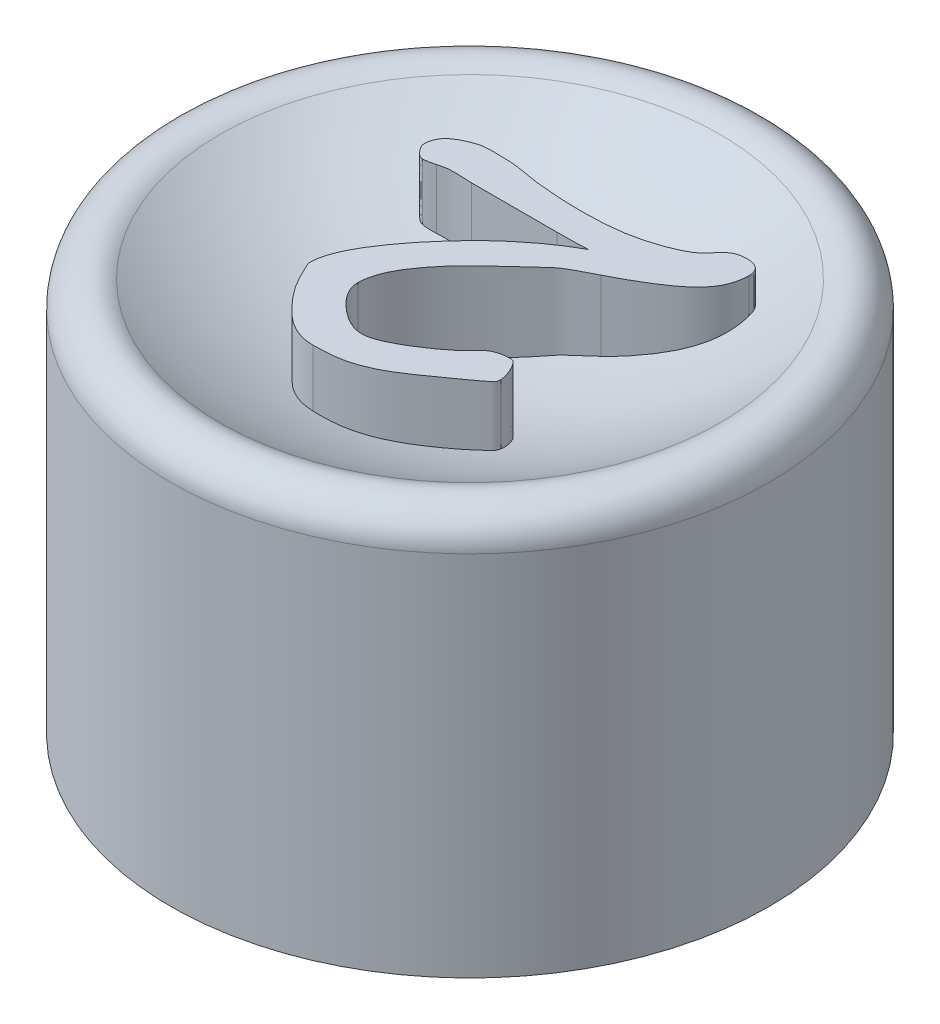
from build123d import *

# Parameters (mm, degrees)
BOSS_EXTRUDE1_REACH      = 11.257
BOSS_EXTRUDE1_END_RADIUS = 7.2532875


with BuildPart() as part:
    # Sketch1 → Revolve1 (revolve)
    with BuildSketch(Plane.XY):
        with BuildLine():
            Line((-1.5494, 0), (-1.5494, 3.048))
            Line((-1.5494, 3.048), (-0.762, 3.048))
            Line((-0.762, 3.048), (-0.762, 4.064))
            Line((-0.762, 4.064), (0, 4.064))
            Line((0, 4.064), (0, 5.08))
            ThreePointArc((0, 5.08), (-2.074697908, 5.383049508), (-3.976029965, 6.266874616))
            ThreePointArc((-3.976029965, 6.266874616), (-4.495955195, 6.288948978), (-4.7625, 5.842))
            Line((-4.7625, 5.842), (-4.7625, 0))
            Line((-4.7625, 0), (-3.4925, 0))
            Line((-3.4925, 0), (-3.4925, 4.064))
            Line((-3.4925, 4.064), (-2.0574, 4.064))
            Line((-2.0574, 4.064), (-2.0574, 0))
            Line((-2.0574, 0), (-1.5494, 0))
        make_face()
    revolve(axis=Axis((0, 0, 0), (0, -1, 0)))

    # Boss-Extrude1: up to this sphere (the profile starts inside it)
    boss_extrude1_end = Location((0, 12.3332875, 0)) * Sphere(BOSS_EXTRUDE1_END_RADIUS, mode=Mode.PRIVATE)
    # Sketch3 → Boss-Extrude1 (add, up to the surface)
    with BuildSketch(Plane(origin=(0, 6.35, 0), x_dir=(-1, 0, 0), z_dir=(0, 1, 0)), mode=Mode.PRIVATE) as boss_extrude1_sk1:
        with BuildLine():
            add(Edge.make_bspline(
                [(-0.625454905, -1.261484771), (-0.59469062, -1.25950277), (-0.526293563, -1.255096264), (-0.413249599, -1.250224058), (-0.279446192, -1.249130747), (-0.183365385, -1.248588222), (-0.131873022, -1.248297468)],
                knots=[0, 0, 0, 0, 0.749056732, 1.665349175, 2.748796024, 4, 4, 4, 4], degree=3))
            add(Edge.make_bspline(
                [(-0.131873022, -1.248297468), (-0.094822983, -1.248297468), (-0.015385186, -1.248297468), (0.112406052, -1.248297468), (0.25683841, -1.248297468), (0.418539854, -1.248297468), (0.596882417, -1.248297468), (0.792180083, -1.248297468), (1.004118869, -1.248297468), (1.151063093, -1.248297468), (1.227361056, -1.248297468)],
                knots=[0, 0, 0, 0, 0.654192654, 1.402633403, 2.256410256, 3.204435204, 4.257796258, 5.405405405, 6.652806653, 8, 8, 8, 8], degree=3))
            add(Edge.make_bspline(
                [(1.227361056, -1.248297468), (1.266920314, -1.250171463), (1.33817871, -1.253547103), (1.433307706, -1.258180588), (1.504903392, -1.258318447), (1.573362551, -1.260008029), (1.654229026, -1.247318142), (1.717367575, -1.230477037), (1.752969244, -1.220980914)],
                knots=[0, 0, 0, 0, 1.345730483, 2.42407467, 3.234936559, 3.779020466, 4.74766559, 6, 6, 6, 6], degree=3))
            add(Edge.make_bspline(
                [(1.752969244, -1.220980914), (1.773032762, -1.216118483), (1.810215907, -1.207107078), (1.862352702, -1.196767521), (1.906602491, -1.189212907), (1.93380023, -1.188385775), (1.946069027, -1.188012658)],
                knots=[0, 0, 0, 0, 1.261736286, 2.338339864, 3.250431406, 4, 4, 4, 4], degree=3))
            add(Edge.make_bspline(
                [(1.946069027, -1.188012658), (1.955706009, -1.188902496), (1.976545755, -1.190826749), (2.006077469, -1.209860248), (2.038490897, -1.235035084), (2.069676258, -1.269915196), (2.100379298, -1.305890557), (2.121699121, -1.34282066), (2.136802351, -1.376546879), (2.139053563, -1.398882071), (2.140110759, -1.409370945)],
                knots=[0, 0, 0, 0, 0.736164041, 1.591937357, 2.642832563, 3.909839565, 5.183763854, 6.279688426, 7.192120982, 8, 8, 8, 8], degree=3))
            add(Edge.make_bspline(
                [(2.140110759, -1.409370945), (2.139262041, -1.426359916), (2.1376141, -1.459347111), (2.12831116, -1.507848604), (2.11073324, -1.552782617), (2.088628361, -1.596138544), (2.057124747, -1.634826974), (2.020789722, -1.671893968), (1.976364606, -1.704738283), (1.911750283, -1.744711804), (1.828207184, -1.785363086), (1.73068096, -1.822729062), (1.638188264, -1.846039901), (1.578195235, -1.849493934), (1.54950801, -1.85114557)],
                knots=[0, 0, 0, 0, 0.756822681, 1.46950967, 2.186023927, 2.898847958, 3.625783312, 4.396672156, 5.204558736, 6.077194631, 7.777390643, 9.3298382, 10.72319279, 12, 12, 12, 12], degree=3))
            Line((1.54950801, -1.85114557), (1.433648141, -1.85114557))
            add(Edge.make_bspline(
                [(1.433648141, -1.85114557), (1.387173127, -1.85080693), (1.300463045, -1.850175118), (1.180370317, -1.845112092), (1.080004307, -1.835287047), (1.020400773, -1.824764773), (0.993757417, -1.820061214)],
                knots=[0, 0, 0, 0, 1.26272939, 2.355919009, 3.265079878, 4, 4, 4, 4], degree=3))
            add(Edge.make_bspline(
                [(0.993757417, -1.820061214), (0.956424278, -1.812985843), (0.879733989, -1.79845151), (0.761116211, -1.779352812), (0.635680481, -1.764626132), (0.503719792, -1.752780155), (0.365301614, -1.74172931), (0.220130555, -1.736095205), (0.068489985, -1.730519236), (-0.034846028, -1.730556782), (-0.087601365, -1.730575949)],
                knots=[0, 0, 0, 0, 0.839077289, 1.723645074, 2.652459622, 3.627336184, 4.649421482, 5.71829468, 6.835138602, 8, 8, 8, 8], degree=3))
            add(Edge.make_bspline(
                [(-0.087601365, -1.730575949), (-0.17714781, -1.732161078), (-0.350627394, -1.735231971), (-0.602818636, -1.760103429), (-0.838401854, -1.800343911), (-1.021858212, -1.85024975), (-1.157283333, -1.895025353), (-1.248376013, -1.928273963), (-1.329809618, -1.96356549), (-1.402404837, -1.998392872), (-1.466726233, -2.03235218), (-1.520935465, -2.068748145), (-1.566682306, -2.104742073), (-1.591554033, -2.131543454), (-1.603199169, -2.144092069)],
                knots=[0, 0, 0, 0, 2.010650531, 3.895261437, 5.685206004, 7.371729088, 8.158868654, 8.888441449, 9.548604563, 10.150993829, 10.696874145, 11.179933583, 11.616038532, 12, 12, 12, 12], degree=3))
            add(Edge.make_bspline(
                [(-1.603199169, -2.144092069), (-1.625262241, -2.169418617), (-1.665705259, -2.215843796), (-1.723750128, -2.276020912), (-1.772371601, -2.32137845), (-1.815213414, -2.352474569), (-1.857642161, -2.371697124), (-1.90355589, -2.385017565), (-1.956222458, -2.391958372), (-1.993463253, -2.393107593), (-2.012947488, -2.393708861)],
                knots=[0, 0, 0, 0, 1.607183726, 2.946070294, 3.999260751, 4.787069689, 5.466056599, 6.217339558, 7.067319197, 8, 8, 8, 8], degree=3))
            add(Edge.make_bspline(
                [(-2.012947488, -2.393708861), (-2.032468039, -2.393026139), (-2.068995766, -2.391748599), (-2.119953899, -2.381406834), (-2.163268425, -2.364574025), (-2.199615366, -2.340682699), (-2.227392589, -2.308563686), (-2.247673856, -2.269982658), (-2.258780761, -2.224446225), (-2.260024397, -2.192190435), (-2.26068038, -2.175176424)],
                knots=[0, 0, 0, 0, 1.239034472, 2.31853671, 3.285102112, 4.17563982, 5.051769498, 5.952741383, 6.920129394, 8, 8, 8, 8], degree=3))
            add(Edge.make_bspline(
                [(-2.26068038, -2.175176424), (-2.259612361, -2.147827776), (-2.257502595, -2.093803203), (-2.245611359, -2.013912578), (-2.22274033, -1.937063604), (-2.194689903, -1.861410593), (-2.154603583, -1.789746412), (-2.108918466, -1.71915227), (-2.052361815, -1.652744721), (-1.988521968, -1.586587854), (-1.913945258, -1.521492576), (-1.828599365, -1.454434893), (-1.73172978, -1.385087282), (-1.62326013, -1.31356441), (-1.503228271, -1.240331639), (-1.372453758, -1.164004794), (-1.229963835, -1.085591192), (-1.130166276, -1.034522263), (-1.078532931, -1.008100178)],
                knots=[0, 0, 0, 0, 0.751185, 1.48389233, 2.209722019, 2.949293268, 3.693671531, 4.458725431, 5.254485927, 6.083539274, 6.981229277, 7.969385974, 9.062642663, 10.250870821, 11.535610741, 12.922400185, 14.407708832, 16, 16, 16, 16], degree=3))
            add(Edge.make_bspline(
                [(-1.078532931, -1.008100178), (-1.048727483, -0.99298493), (-0.992247353, -0.964342142), (-0.911613146, -0.924302928), (-0.841057897, -0.88615454), (-0.77895012, -0.852683481), (-0.72626366, -0.822428967), (-0.682354035, -0.796556367), (-0.648788815, -0.772606016), (-0.61994277, -0.751958385), (-0.592320764, -0.727575338), (-0.558271351, -0.697601369), (-0.516220078, -0.658211328), (-0.462758515, -0.613275449), (-0.403333748, -0.556328132), (-0.331805498, -0.494258481), (-0.253599018, -0.421342626), (-0.13891454, -0.317275518), (0.000817298, -0.187642525), (0.152554591, -0.036177362), (0.282092347, 0.103271603), (0.391311247, 0.231503999), (0.481467896, 0.351749621), (0.55834102, 0.463468997), (0.621152834, 0.568985897), (0.669811587, 0.669081523), (0.707014311, 0.76390152), (0.733904878, 0.854222616), (0.749632188, 0.941192316), (0.752271231, 0.997882827), (0.753560127, 1.025570214)],
                knots=[0, 0, 0, 0, 0.993452754, 1.882553178, 2.675913279, 3.377614943, 3.979617166, 4.482249507, 4.891335973, 5.20495211, 5.536000706, 5.985568739, 6.553772543, 7.248298836, 8.060755253, 8.999425181, 10.063010678, 11.238976278, 13.603062434, 15.728225716, 17.610593724, 19.259799451, 20.732653877, 22.076245429, 23.289619701, 24.379140742, 25.380976476, 26.314341301, 27.176732013, 28, 28, 28, 28], degree=3))
            add(Edge.make_bspline(
                [(0.753560127, 1.025570214), (0.752882266, 1.044158382), (0.751511873, 1.081736998), (0.738598675, 1.137926472), (0.717188997, 1.193857053), (0.689055389, 1.250722137), (0.651692954, 1.307045096), (0.60725962, 1.364012749), (0.553805779, 1.420517576), (0.494187125, 1.47631058), (0.431226687, 1.529058398), (0.368358268, 1.576426024), (0.306121936, 1.616366551), (0.244697444, 1.648180207), (0.18520218, 1.674370891), (0.126437129, 1.692424655), (0.068527183, 1.703159118), (0.0301843, 1.70483365), (0.011303402, 1.705658228)],
                knots=[0, 0, 0, 0, 0.824177761, 1.66619214, 2.543788213, 3.478718722, 4.476075317, 5.538318038, 6.682181307, 7.924541009, 9.161180757, 10.32632742, 11.416634385, 12.438996086, 13.394273658, 14.298039817, 15.161916508, 16, 16, 16, 16], degree=3))
            add(Edge.make_bspline(
                [(0.011303402, 1.705658228), (-0.005703183, 1.704841533), (-0.041927539, 1.703101956), (-0.098987029, 1.690704952), (-0.161744345, 1.671584132), (-0.23120297, 1.646048415), (-0.306147505, 1.611845228), (-0.387060195, 1.569799295), (-0.475040027, 1.522240565), (-0.595605224, 1.448102868), (-0.740392153, 1.35318798), (-0.897280656, 1.237991551), (-1.030244279, 1.124730663), (-1.104051946, 1.043874925), (-1.138817741, 1.00578926)],
                knots=[0, 0, 0, 0, 0.44717723, 0.952496219, 1.529937352, 2.172717319, 2.897203703, 3.694987228, 4.570926422, 5.526944935, 7.416611049, 9.122832278, 10.64476105, 12, 12, 12, 12], degree=3))
            add(Edge.make_bspline(
                [(-1.138817741, 1.00578926), (-1.161374536, 0.983468315), (-1.207007375, 0.938312604), (-1.297073141, 0.892525235), (-1.402377576, 0.866867887), (-1.477763659, 0.863464173), (-1.517481705, 0.861670886)],
                knots=[0, 0, 0, 0, 0.907338094, 1.835562752, 2.859640733, 4, 4, 4, 4], degree=3))
            add(Edge.make_bspline(
                [(-1.517481705, 0.861670886), (-1.528248123, 0.863641567), (-1.552878243, 0.868149855), (-1.584462066, 0.899150911), (-1.617639977, 0.942384716), (-1.649758591, 0.999665231), (-1.678160039, 1.061934468), (-1.69995491, 1.121100297), (-1.714586593, 1.173397081), (-1.717005475, 1.206351441), (-1.718117089, 1.221495847)],
                knots=[0, 0, 0, 0, 0.597167611, 1.366128372, 2.361407725, 3.652027743, 4.99575411, 6.166635867, 7.157464792, 8, 8, 8, 8], degree=3))
            add(Edge.make_bspline(
                [(-1.718117089, 1.221495847), (-1.71752053, 1.238270073), (-1.71652674, 1.266213761), (-1.709128597, 1.29981871), (-1.691843557, 1.315275905), (-1.675176888, 1.330603814), (-1.64824634, 1.350682486), (-1.61385464, 1.378223402), (-1.570268458, 1.411307585), (-1.517320302, 1.449540331), (-1.456063315, 1.495142271), (-1.363577555, 1.562840934), (-1.245495872, 1.648343048), (-1.106723717, 1.746201105), (-0.976276236, 1.837641443), (-0.852161397, 1.921928759), (-0.731039052, 1.996695579), (-0.611428082, 2.063745553), (-0.490470669, 2.11888563), (-0.367378803, 2.166867443), (-0.234895314, 2.204698094), (-0.087834017, 2.230294169), (0.07631687, 2.244882376), (0.191184938, 2.247071853), (0.251500692, 2.248221519)],
                knots=[0, 0, 0, 0, 0.486333776, 0.81016903, 0.924485804, 1.140790748, 1.460615503, 1.882845017, 2.401992422, 3.025355066, 3.751086249, 4.586420913, 6.303969344, 7.921276254, 9.443646414, 10.861057166, 12.212030398, 13.514482498, 14.780374729, 16.011374719, 17.290736796, 18.714252516, 20.274695985, 22, 22, 22, 22], degree=3))
            add(Edge.make_bspline(
                [(0.251500692, 2.248221519), (0.278222715, 2.247136084), (0.331620647, 2.244967086), (0.411145131, 2.233003695), (0.48872054, 2.210408239), (0.565802239, 2.181523433), (0.641027387, 2.142508511), (0.714870491, 2.094890447), (0.787629167, 2.039100975), (0.880765238, 1.954485149), (0.988598804, 1.844173204), (1.102927862, 1.709242791), (1.200563767, 1.576164106), (1.265892821, 1.464295081), (1.309141997, 1.379189243), (1.337084636, 1.323770346), (1.362017322, 1.276253827), (1.381096151, 1.234918481), (1.395883238, 1.200531336), (1.407203041, 1.173413779), (1.414985973, 1.153453493), (1.416214231, 1.142091487), (1.416693038, 1.137662282)],
                knots=[0, 0, 0, 0, 0.944426051, 1.887222376, 2.831843805, 3.793822867, 4.790906319, 5.818552965, 6.89450712, 8.025645203, 10.261033004, 12.338770317, 14.269016685, 16.083793158, 16.907274113, 17.641425429, 18.276371991, 18.802381606, 19.249503192, 19.59761365, 19.843139371, 20, 20, 20, 20], degree=3))
            add(Edge.make_bspline(
                [(1.416693038, 1.137662282), (1.414436996, 1.09918529), (1.409679433, 1.018044673), (1.376623891, 0.892342571), (1.326245464, 0.756554954), (1.25560985, 0.610124603), (1.16431334, 0.453966193), (1.053217069, 0.287202054), (0.923433416, 0.109118895), (0.774549194, -0.074384075), (0.615949674, -0.259079688), (0.449594096, -0.435294684), (0.280675683, -0.601446917), (0.106578651, -0.755142108), (-0.070582343, -0.898589305), (-0.251013854, -1.031363201), (-0.435430323, -1.153043233), (-0.562254167, -1.225417936), (-0.625454905, -1.261484771)],
                knots=[0, 0, 0, 0, 0.569885039, 1.201778558, 1.91564769, 2.71472284, 3.606852301, 4.593955034, 5.682686568, 6.870631706, 8.094332463, 9.289036117, 10.460237748, 11.603846804, 12.728591835, 13.836829883, 14.922016996, 16, 16, 16, 16], degree=3))
        make_face()
    boss_extrude1_tool1 = extrude(boss_extrude1_sk1.sketch, amount=-BOSS_EXTRUDE1_REACH, mode=Mode.PRIVATE) & boss_extrude1_end
    add(boss_extrude1_tool1.solids().sort_by_distance((0.377709, 6.35, -1.314178))[0])


solid = part.part
